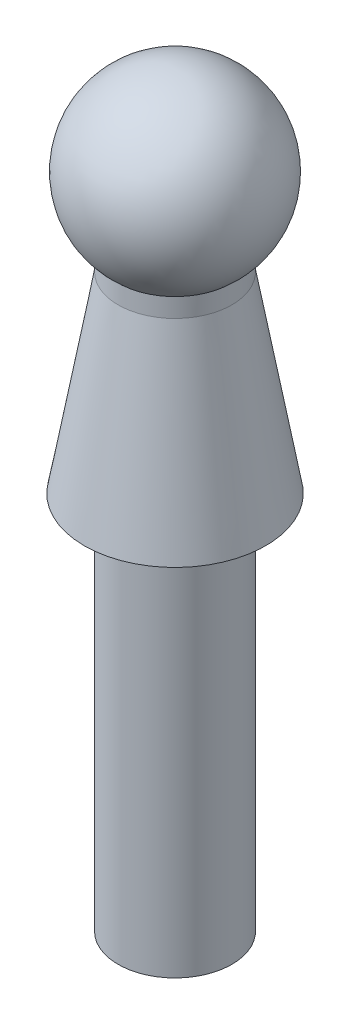
from build123d import *


with BuildPart() as part:
    # Sketch1 → Revolve1 (revolve)
    with BuildSketch(Plane.XY, mode=Mode.PRIVATE) as revolve1_sk:
        with BuildLine():
            Line((0, 0), (6, 0))
            Line((6, 0), (6, 40))
            Line((6, 40), (9.563269807, 40))
            Line((9.563269807, 40), (6, 60.208307275))
            Line((6, 60.208307275), (6, 62.208307275))
            ThreePointArc((6, 62.208307275), (8.799195225, 72.583490389), (0, 78.752289458))
            Line((0, 78.752289458), (0, 0))
        make_face()
    revolve(revolve1_sk.sketch.rotate(Axis((0, 0, 0), (0, 1, 0)), 90), axis=Axis((0, 0, 0), (0, 1, 0)))


solid = part.part
